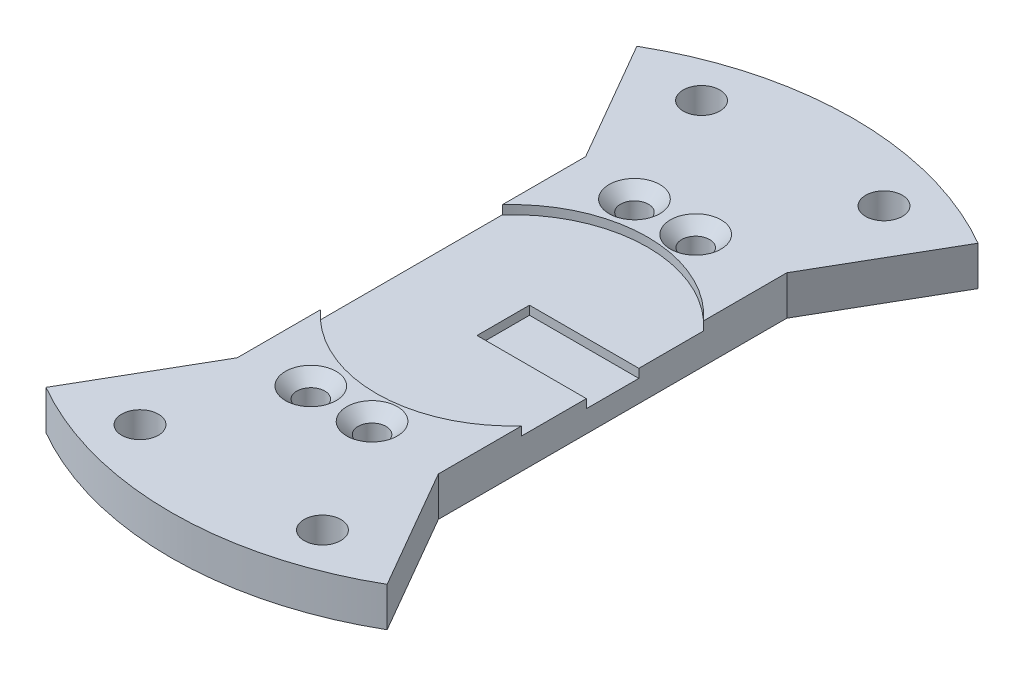
from build123d import *

# Parameters (mm, degrees)
SKETCH1_R                                           = 2.1
BOSS_EXTRUDE1_DEPTH                                 = 4.5
SKETCH2_R                                           = 15.5
CUT_EXTRUDE1_DEPTH                                  = 1
SKETCH3_W                                           = 12.5
SKETCH3_H                                           = 6
CUT_EXTRUDE2_DEPTH                                  = 1
SKETCH4_R                                           = 1.6
CUT_EXTRUDE3_DEPTH                                  = 44.834917589
CSK_FOR_M4_COUNTERSUNK_FLAT_HEAD_SCREW1_D           = 3.2
CSK_FOR_M4_COUNTERSUNK_FLAT_HEAD_SCREW1_CSINK_D     = 5.8
CSK_FOR_M4_COUNTERSUNK_FLAT_HEAD_SCREW1_CSINK_ANGLE = 90


with BuildPart() as part:
    # Sketch1 → Boss-Extrude1 (new body)
    # profile 1 of 4: a face of its own
    with BuildSketch(Plane(origin=(0, 0, 0), x_dir=(1, 0, 0), z_dir=(0, 1, 0))):
        with BuildLine():
            Line((11.5, -19.918584287), (0, 0))
            Line((0, 0), (-11.5, -19.918584287))
            Line((-11.5, -19.918584287), (-19.5, -33.774990748))
            ThreePointArc((-19.5, -33.774990748), (0, -39), (19.5, -33.774990748))
            Line((19.5, -33.774990748), (11.5, -19.918584287))
        make_face()
        with Locations(Location((-10.42932356, -32.098157425, 0), (0, 0, 270))):
            Circle(SKETCH1_R, mode=Mode.SUBTRACT)
        with Locations(Location((10.42932356, -32.098157425, 0), (0, 0, 270))):
            Circle(SKETCH1_R, mode=Mode.SUBTRACT)
    # profile 2 of 4: a face of its own
    with BuildSketch(Plane(origin=(0, 0, 0), x_dir=(1, 0, 0), z_dir=(0, 1, 0))):
        Polygon((11.5, 19.918584287), (0, 0), (11.5, -19.918584287), align=None)
    # profile 3 of 4: a face of its own
    with BuildSketch(Plane(origin=(0, 0, 0), x_dir=(1, 0, 0), z_dir=(0, 1, 0))):
        with BuildLine():
            Line((-11.5, 19.918584287), (0, 0))
            Line((0, 0), (11.5, 19.918584287))
            Line((11.5, 19.918584287), (19.5, 33.774990748))
            ThreePointArc((19.5, 33.774990748), (0, 39), (-19.5, 33.774990748))
            Line((-19.5, 33.774990748), (-11.5, 19.918584287))
        make_face()
        with Locations(Location((-10.42932356, 32.098157425, 0), (0, 0, 270))):
            Circle(SKETCH1_R, mode=Mode.SUBTRACT)
        with Locations(Location((10.42932356, 32.098157425, 0), (0, 0, 270))):
            Circle(SKETCH1_R, mode=Mode.SUBTRACT)
    # profile 4 of 4: a face of its own
    with BuildSketch(Plane(origin=(0, 0, 0), x_dir=(1, 0, 0), z_dir=(0, 1, 0))):
        Polygon((-11.5, -19.918584287), (0, 0), (-11.5, 19.918584287), align=None)
    extrude(amount=BOSS_EXTRUDE1_DEPTH)

    # Sketch2 → Cut-Extrude1 (cut)
    with BuildSketch(Plane(origin=(0, 4.5, 0), x_dir=(1, 0, 0), z_dir=(0, 1, 0))):
        Circle(SKETCH2_R)
    extrude(amount=-CUT_EXTRUDE1_DEPTH, mode=Mode.SUBTRACT)

    # Sketch3 → Cut-Extrude2 (cut)
    with BuildSketch(Plane(origin=(0, 3.5, 0), x_dir=(1, 0, 0), z_dir=(0, 1, 0))):
        with Locations((5.25, 0)):
            Rectangle(SKETCH3_W, SKETCH3_H)
    extrude(amount=-CUT_EXTRUDE2_DEPTH, mode=Mode.SUBTRACT)

    # Sketch4 → Cut-Extrude3 (cut, through all)
    with BuildSketch(Plane(origin=(0, 4.5, 0), x_dir=(1, 0, 0), z_dir=(0, 1, 0))):
        with Locations(Location((-4.5, -18.5, 0), (0, 0, 270))):
            Circle(SKETCH4_R)
        with Locations(Location((2.5, -18.5, 0), (0, 0, 270))):
            Circle(SKETCH4_R)
        with Locations(Location((-4.5, 18.5, 0), (0, 0, 270))):
            Circle(SKETCH4_R)
        with Locations(Location((2.5, 18.5, 0), (0, 0, 270))):
            Circle(SKETCH4_R)
    extrude(amount=-CUT_EXTRUDE3_DEPTH, mode=Mode.SUBTRACT)

    # CSK for M4 Countersunk Flat Head Screw1 (through all)
    with Locations(Plane(origin=(-4.5, 4.5, 18.5), x_dir=(0, 0, 1), z_dir=(0, 1, 0))):
        with Locations((0, 0), (0, 7), (-37, 0), (-37, 7)):
            CounterSinkHole(CSK_FOR_M4_COUNTERSUNK_FLAT_HEAD_SCREW1_D / 2, CSK_FOR_M4_COUNTERSUNK_FLAT_HEAD_SCREW1_CSINK_D / 2, counter_sink_angle=CSK_FOR_M4_COUNTERSUNK_FLAT_HEAD_SCREW1_CSINK_ANGLE)


solid = part.part
